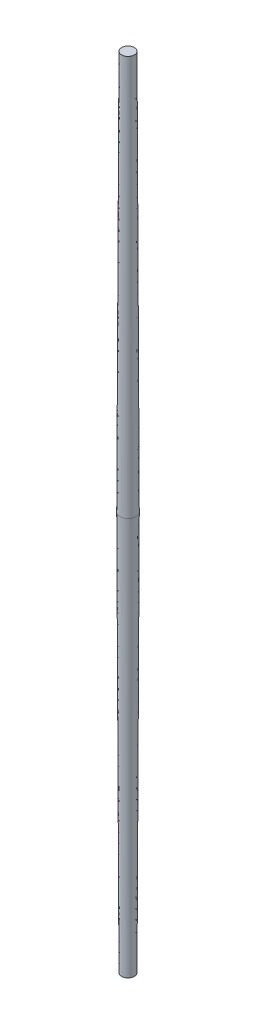
from build123d import *

# Parameters (mm, degrees)
ECHELLE1_SCALE = 0.6


with BuildPart() as part:
    # Esquisse1 → Révolution1 (revolve)
    with BuildSketch(Plane.XY, mode=Mode.PRIVATE) as r_volution1_sk:
        Polygon((0, 0), (5, 0), (4, 250), (0, 250), align=None)
    r_volution1 = revolve(r_volution1_sk.sketch.rotate(Axis((0, 250, 0), (0, -1, 0)), 180), axis=Axis((0, 250, 0), (0, -1, 0)))

    # Symétrie1: Révolution1 across plane
    add(r_volution1.mirror(Plane.ZX))


with BuildPart() as part_1:
    # Echelle1: scaled about (0, 0, 0)
    add(part.part.scale(ECHELLE1_SCALE))


solid = part_1.part
